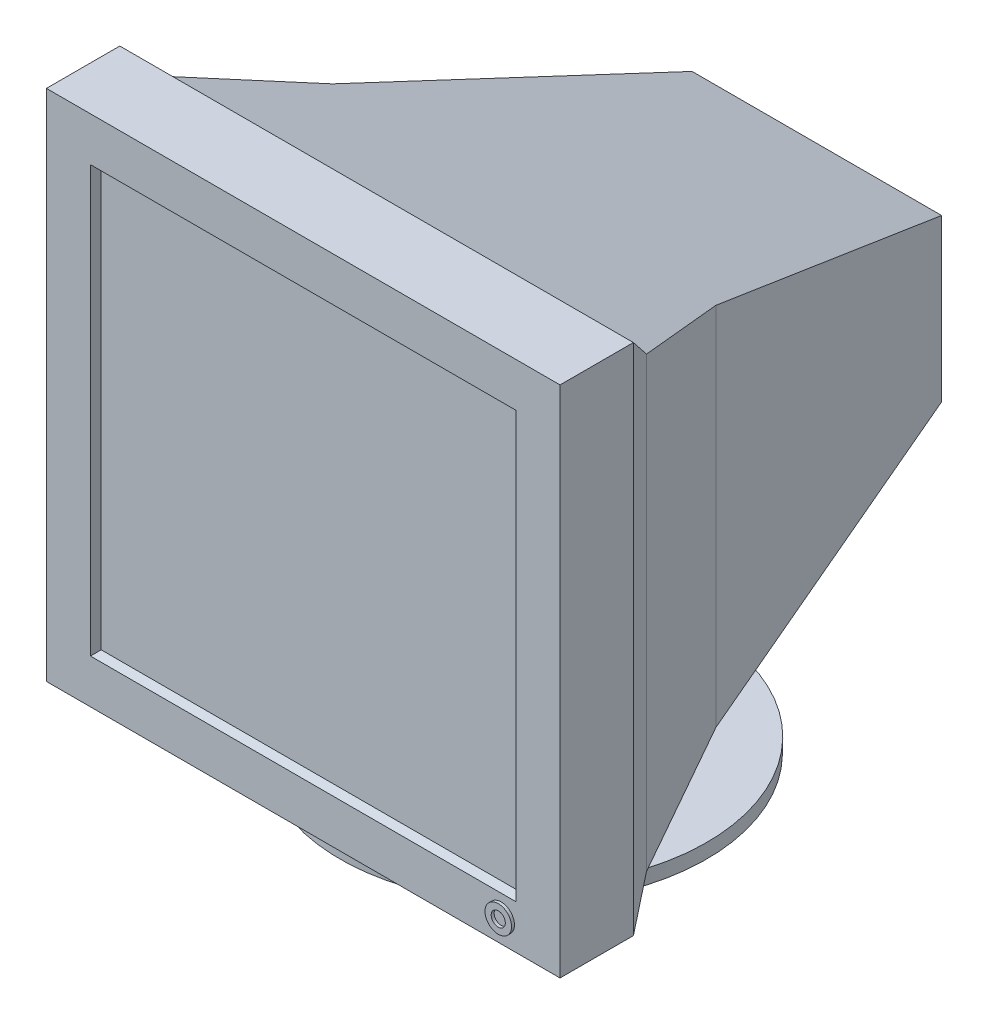
from build123d import *

# Parameters (mm, degrees)
CROQUIS1_W                   = 350
CROQUIS1_H                   = 350
SALIENTE_EXTRUIR1_DEPTH      = 350
CROQUIS2_W                   = 290
CROQUIS2_H                   = 290
CORTAR_EXTRUIR1_DEPTH        = 5
CORTAR_EXTRUIR1_DRAFT        = -25
CORTAR_EXTRUIR2_REACH        = 527
CORTAR_EXTRUIR3_REACH        = 527
SALIENTE_EXTRUIR2_DEPTH      = 20
SALIENTE_EXTRUIR2_DEPTH_BACK = 85
CROQUIS5_R                   = 53.324987264
CROQUIS6_R                   = 125
SALIENTE_EXTRUIR3_DEPTH      = 10
SALIENTE_EXTRUIR3_TAPER      = 1
CROQUIS7_R                   = 9.05214815
SALIENTE_EXTRUIR4_DEPTH      = 2
CROQUIS8_R                   = 4.817972318
CORTAR_EXTRUIR4_DEPTH        = 2


with BuildPart() as part:
    # Croquis1 → Saliente-Extruir1 (new body)
    with BuildSketch(Plane.XY):
        Rectangle(CROQUIS1_W, CROQUIS1_H)
    extrude(amount=-SALIENTE_EXTRUIR1_DEPTH)


with BuildPart() as cortar_extruir1_tool:
    # Croquis2 → Cortar-Extruir1 (with draft: the straight prism first)
    with BuildSketch(Plane.XY):
        Rectangle(CROQUIS2_W, CROQUIS2_H)
    extrude(amount=-CORTAR_EXTRUIR1_DEPTH)
    # Cortar-Extruir1: the draft: its side faces are tilted about the plane it starts from
    cortar_extruir1_sides = [cortar_extruir1_tool.faces().sort_by_distance(p)[0] for p in [
        (-145, 0, -2.5),
        (0, -145, -2.5),
        (145, 0, -2.5),
        (0, 145, -2.5),
    ]]
    draft(cortar_extruir1_sides, Plane.XY, CORTAR_EXTRUIR1_DRAFT)


with BuildPart() as part_1:
    add(part.part)

    # Cortar-Extruir1: cut by cortar_extruir1_tool
    add(cortar_extruir1_tool.part, mode=Mode.SUBTRACT)

    # Croquis3 → Cortar-Extruir2 (cut, up to next)
    with BuildSketch(Plane(origin=(175, 0, 0), x_dir=(0, 0, -1), z_dir=(1, 0, 0)), mode=Mode.PRIVATE) as cortar_extruir2_sk1:
        Polygon((50, 175), (70, 152.639320225), (350, 55), (350, 175), align=None)
    cortar_extruir2_tool1 = extrude(cortar_extruir2_sk1.sketch, amount=-CORTAR_EXTRUIR2_REACH, mode=Mode.PRIVATE) & part_1.part
    # Croquis3 → Cortar-Extruir2 (cut, up to next)
    with BuildSketch(Plane(origin=(175, 0, 0), x_dir=(0, 0, -1), z_dir=(1, 0, 0)), mode=Mode.PRIVATE) as cortar_extruir2_sk2:
        Polygon((350, -175), (50, -175), (70, -152.639320225), (350, -55), align=None)
    cortar_extruir2_tool2 = extrude(cortar_extruir2_sk2.sketch, amount=-CORTAR_EXTRUIR2_REACH, mode=Mode.PRIVATE) & part_1.part
    add(cortar_extruir2_tool1.solids().sort_by_distance((175, 134.203352, -240.024387))[0], mode=Mode.SUBTRACT)
    add(cortar_extruir2_tool2.solids().sort_by_distance((175, -134.203352, -240.024387))[0], mode=Mode.SUBTRACT)

    # Croquis4 → Cortar-Extruir3 (cut, up to next)
    with BuildSketch(Plane(origin=(0, 175, 0), x_dir=(1, 0, 0), z_dir=(0, 1, 0)), mode=Mode.PRIVATE) as cortar_extruir3_sk1:
        Polygon((-85, 350), (-175, 350), (-175, 50), (-163.915974354, 70), (-130.682151375, 150.497096617), align=None)
    cortar_extruir3_tool1 = extrude(cortar_extruir3_sk1.sketch, amount=-CORTAR_EXTRUIR3_REACH, mode=Mode.PRIVATE) & part_1.part
    # Croquis4 → Cortar-Extruir3 (cut, up to next)
    with BuildSketch(Plane(origin=(0, 175, 0), x_dir=(1, 0, 0), z_dir=(0, 1, 0)), mode=Mode.PRIVATE) as cortar_extruir3_sk2:
        Polygon((130.682151375, 150.497096617), (85, 350), (175, 350), (175, 50), (163.915974354, 70), align=None)
    cortar_extruir3_tool2 = extrude(cortar_extruir3_sk2.sketch, amount=-CORTAR_EXTRUIR3_REACH, mode=Mode.PRIVATE) & part_1.part
    add(cortar_extruir3_tool1.solids().sort_by_distance((-143.088568, 175, -239.864683))[0], mode=Mode.SUBTRACT)
    add(cortar_extruir3_tool2.solids().sort_by_distance((143.088568, 175, -239.864683))[0], mode=Mode.SUBTRACT)

    # Croquis5 → Saliente-Extruir2 (add, two sides: drawn at the far end of the back side and taken through both)
    with BuildSketch(Plane.XZ.offset(175).offset(-SALIENTE_EXTRUIR2_DEPTH_BACK)):
        with Locations(Location((0, -150, 0), (0, 0, 270))):
            Circle(CROQUIS5_R)
    extrude(amount=SALIENTE_EXTRUIR2_DEPTH + SALIENTE_EXTRUIR2_DEPTH_BACK)

    # Croquis6 → Saliente-Extruir3 (add)
    with BuildSketch(Plane.XZ.offset(195)):
        with Locations((0, -150)):
            Circle(CROQUIS6_R)
    extrude(amount=SALIENTE_EXTRUIR3_DEPTH, taper=SALIENTE_EXTRUIR3_TAPER)

    # Croquis7 → Saliente-Extruir4 (add)
    with BuildSketch(Plane.XY):
        with Locations((134.907856816, -159.198773435)):
            Circle(CROQUIS7_R)
    extrude(amount=SALIENTE_EXTRUIR4_DEPTH)

    # Croquis8 → Cortar-Extruir4 (cut)
    with BuildSketch(Plane.XY.offset(2)):
        with Locations((134.907856816, -159.198773435)):
            Circle(CROQUIS8_R)
    extrude(amount=-CORTAR_EXTRUIR4_DEPTH, mode=Mode.SUBTRACT)


solid = part_1.part
